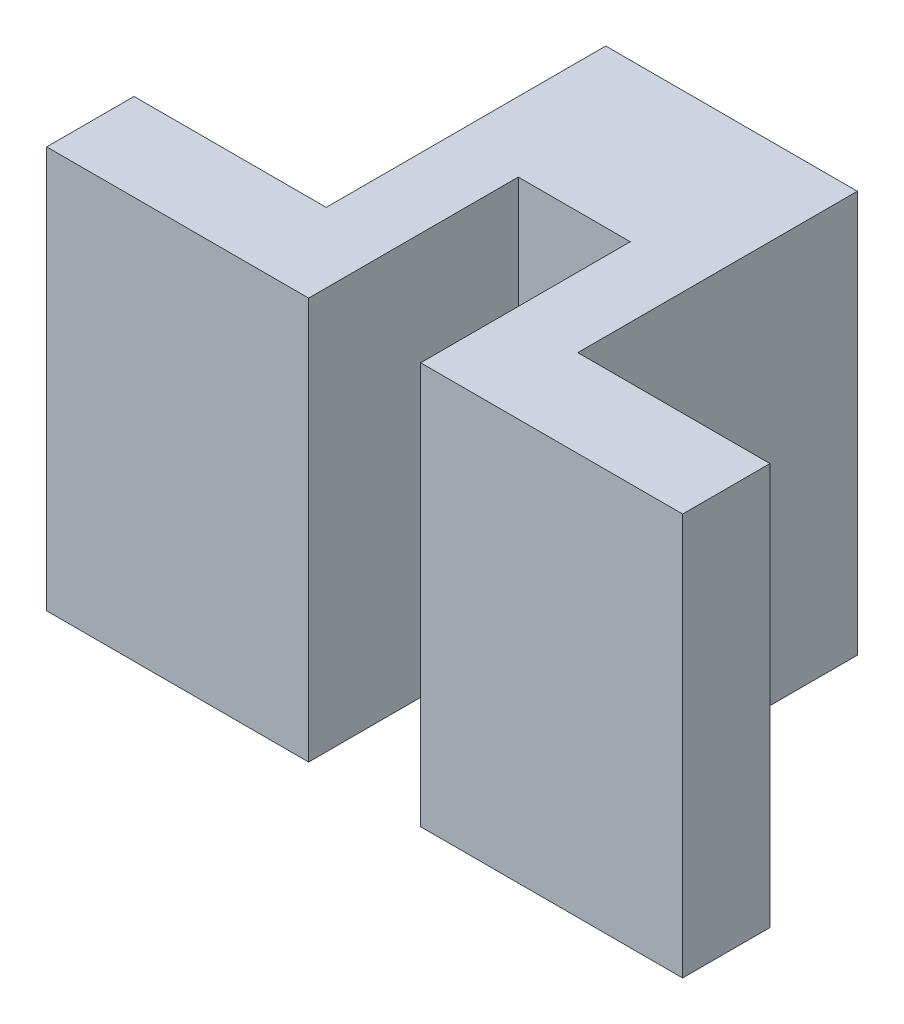
from build123d import *

# Parameters (mm, degrees)
SKETCH1_W           = 9.1
SKETCH1_H           = 5.75
BOSS_EXTRUDE1_DEPTH = 1.25
SKETCH3_W           = 3.6
SKETCH3_H           = 5.75
BOSS_EXTRUDE2_DEPTH = 4
SKETCH2_W           = 1.60331862
SKETCH2_H           = 15
CUT_EXTRUDE1_DEPTH  = 3


with BuildPart() as part:
    # Sketch1 → Boss-Extrude1 (new body)
    with BuildSketch(Plane.XY):
        with Locations((-13.05, 11.375)):
            Rectangle(SKETCH1_W, SKETCH1_H)
    extrude(amount=BOSS_EXTRUDE1_DEPTH)

    # Sketch3 → Boss-Extrude2 (add)
    with BuildSketch(Plane(origin=(0, 0, 0), x_dir=(-1, 0, 0), z_dir=(0, 0, -1))):
        with Locations((13.05, 11.375)):
            Rectangle(SKETCH3_W, SKETCH3_H)
    extrude(amount=BOSS_EXTRUDE2_DEPTH)

    # Sketch2 → Cut-Extrude1 (cut)
    with BuildSketch(Plane.XY.offset(1.25)):
        with Locations((-13.05, 11.375)):
            Rectangle(SKETCH2_W, SKETCH2_H)
    extrude(amount=-CUT_EXTRUDE1_DEPTH, mode=Mode.SUBTRACT)


solid = part.part
